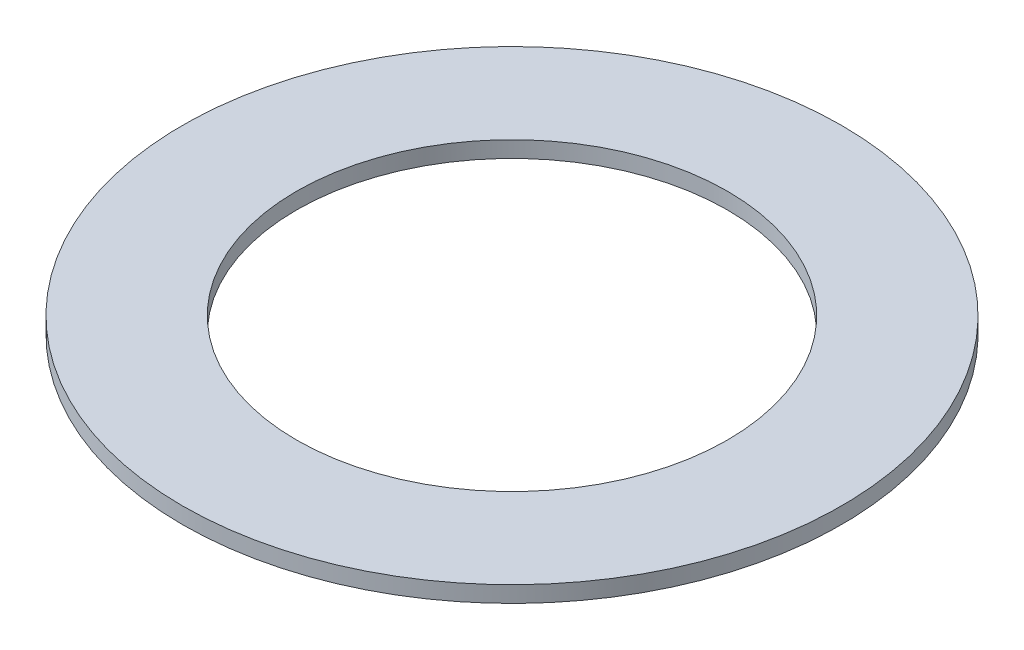
from build123d import *

# Parameters (mm, degrees)
SKETCH1_R           = 60.807971184
SKETCH1_R_2         = 39.762100618
BOSS_EXTRUDE1_DEPTH = 3


with BuildPart() as part:
    # Sketch1 → Boss-Extrude1 (new body)
    with BuildSketch(Plane(origin=(0, 0, 0), x_dir=(1, 0, 0), z_dir=(0, 1, 0))):
        with Locations(Location((0, 0, 0), (0, 0, 270))):
            Circle(SKETCH1_R)
        with Locations(Location((0, 0, 0), (0, 0, 270))):
            Circle(SKETCH1_R_2, mode=Mode.SUBTRACT)
    extrude(amount=BOSS_EXTRUDE1_DEPTH)


solid = part.part
